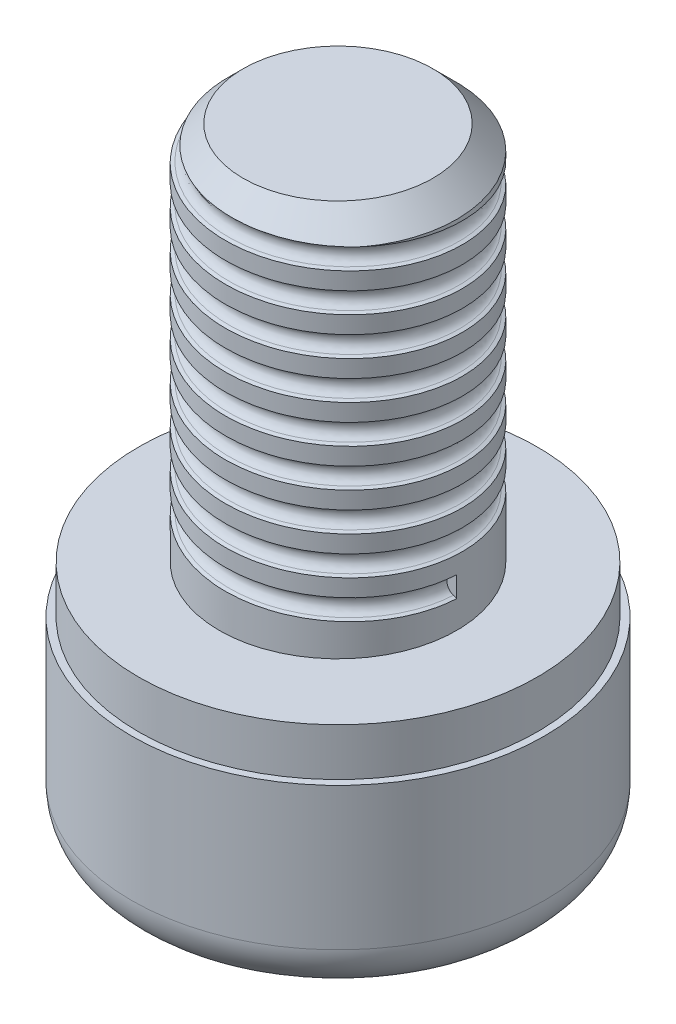
from build123d import *

# Parameters (mm, degrees)
SKETCH_1_R          = 4.35
EXTRUDE_1_DEPTH     = 5
SKETCH_2_R          = 2.5
EXTRUDE_2_DEPTH     = 8
CHAMFER_1_SIZE      = 0.5
CUT_EXTRUDE_1_DEPTH = 2.5
FILLET_1_R          = 1
CUT_EXTRUDE_START   = -1
SKETCH_4_R          = 4.35
SKETCH_4_R_2        = 4.2
CUT_EXTRUDE_3_DEPTH = 1
SWEEP_1_PITCH       = 0.8
SWEEP_1_HEIGHT      = 7.2
SWEEP_1_RADIUS      = 2.5
SWEEP_1_START_ANGLE = 90


with BuildPart() as part:
    # Эскиз1 → Бобышка-Вытянуть1 (new body)
    with BuildSketch(Plane(origin=(0, 0, 0), x_dir=(1, 0, 0), z_dir=(0, 1, 0))):
        with Locations(Location((0, 0, 0), (0, 0, 270))):
            Circle(SKETCH_1_R)
    extrude(amount=EXTRUDE_1_DEPTH)

    # Эскиз2 → Бобышка-Вытянуть2 (add)
    with BuildSketch(Plane(origin=(0, 5, 0), x_dir=(1, 0, 0), z_dir=(0, 1, 0))):
        with Locations(Location((0, 0, 0), (0, 0, 270))):
            Circle(SKETCH_2_R)
    extrude(amount=EXTRUDE_2_DEPTH)

    # Фаска1
    chamfer_1_edges = [part.edges().sort_by_distance(p)[0] for p in [
        (0, 13, -2.5),
    ]]
    chamfer(chamfer_1_edges, length=CHAMFER_1_SIZE)

    # Эскиз3 → Вырез-Вытянуть1 (cut)
    with BuildSketch(Plane.XZ):
        Polygon((1.989239345, -1.173141152), (2.010589712, 1.136161231), (0.021350368, 2.309302383), (-1.989239345, 1.173141152), (-2.010589712, -1.136161231), (-0.021350368, -2.309302383), align=None)
    extrude(amount=-CUT_EXTRUDE_1_DEPTH, mode=Mode.SUBTRACT)

    # Скругление1
    fillet_1_edges = [part.edges().sort_by_distance(p)[0] for p in [
        (0, 0, -4.35),
    ]]
    fillet(fillet_1_edges, radius=FILLET_1_R)

    # Эскиз4 → Вырез-Вытянуть3 (cut)
    with BuildSketch(Plane(origin=(0, 5, 0), x_dir=(1, 0, 0), z_dir=(0, 1, 0)).offset(CUT_EXTRUDE_START)):
        with Locations(Location((0, 0, 0), (0, 0, 270))):
            Circle(SKETCH_4_R)
        with Locations(Location((0, 0, 0), (0, 0, 270))):
            Circle(SKETCH_4_R_2, mode=Mode.SUBTRACT)
    extrude(amount=CUT_EXTRUDE_3_DEPTH, mode=Mode.SUBTRACT)

    # Вырез-По траектории1: sweep along a helix
    with BuildLine() as sweep_1_path:
        add(Helix(SWEEP_1_PITCH, SWEEP_1_HEIGHT, SWEEP_1_RADIUS, center=(0, 12.5, 0), direction=(0, -1, 0), lefthand=True, mode=Mode.PRIVATE).rotate(Axis((0, 12.5, 0), (0, -1, 0)), SWEEP_1_START_ANGLE))
    # Эскиз10 → Вырез-По траектории1 (sweep, cut)
    with BuildSketch(Plane.XY):
        with BuildLine():
            Line((2.9, 13.363970234), (2.9, 12.636029766))
            Line((2.9, 12.636029766), (2.429813333, 12.807163717))
            ThreePointArc((2.429813333, 12.807163717), (2.294787914, 13), (2.429813333, 13.192836283))
            Line((2.429813333, 13.192836283), (2.9, 13.363970234))
        make_face()
    sweep(path=sweep_1_path.line, is_frenet=True, mode=Mode.SUBTRACT)


solid = part.part
